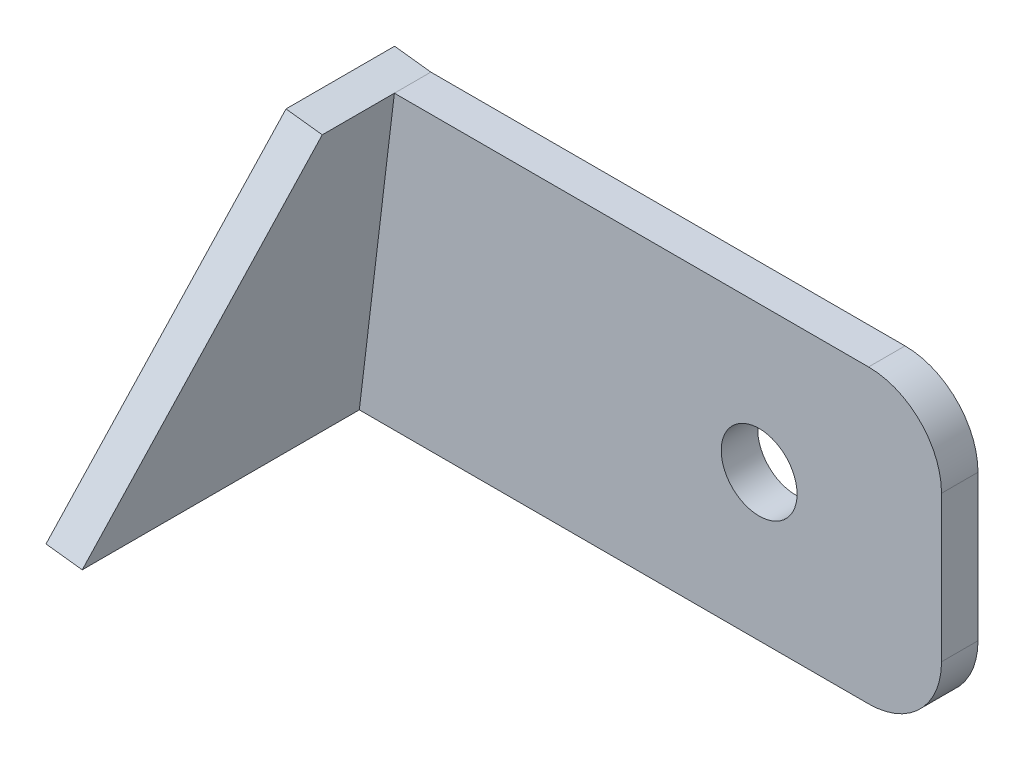
from build123d import *

# Parameters (mm, degrees)
BOSS_EXTRUDE1_DEPTH     = 3.175
CUT_EXTRUDE1_DEPTH      = 50.391408666
CUT_EXTRUDE1_DEPTH_BACK = 50.391408666
SKETCH3_R               = 3.302
SKETCH2_W               = 3.175
SKETCH2_H               = 6.4135
BOSS_EXTRUDE2_DEPTH     = 3.175
FILLET1_R               = 6.35


with BuildPart() as part:
    # Sketch1 → Boss-Extrude1 (new body)
    with BuildSketch(Plane.XY):
        Polygon((0, 12.7), (-3.051249826, -12.7), (0, -12.7), (47.625, -12.7), (47.625, 12.7), align=None)
        Polygon((-2.271161455, -6.206187377), (-0.780088372, 6.206187377), (-3.932424596, 6.584871053), (-5.42349768, -5.827503701), align=None)
    extrude(amount=BOSS_EXTRUDE1_DEPTH)

    # Sketch3 → Cut-Extrude1 (cut, two sides: drawn at the far end of the back side and taken through both)
    with BuildSketch(Plane.XY.offset(3.175).offset(-CUT_EXTRUDE1_DEPTH_BACK)):
        with Locations((31.75, 0)):
            Circle(SKETCH3_R)
    extrude(amount=CUT_EXTRUDE1_DEPTH + CUT_EXTRUDE1_DEPTH_BACK, mode=Mode.SUBTRACT)

    # Fillet1
    fillet1_edges = [part.edges().sort_by_distance(p)[0] for p in [
        (47.625, 12.7, 1.5875),
        (47.625, -12.7, 1.5875),
    ]]
    fillet(fillet1_edges, radius=FILLET1_R)


with BuildPart() as body_2:
    # Sketch2 → Boss-Extrude2 (new body)
    with BuildSketch(Plane(origin=(-1.503922228, 0.180663088, 0), x_dir=(0, 0, 1), z_dir=(-0.9928618030717177, 0.11927044898539502, 0))):
        with Locations((1.5875, -9.766518836)):
            Rectangle(SKETCH2_W, SKETCH2_H)
        Polygon((0, 12.609344899), (0, 6.195844899), (3.175, 6.195844899), (3.175, -6.432768836), (3.175, -6.559768836), (3.175, -12.973268836), (27.295308913, -12.973268836), (9.453791039, 12.609344899), align=None)
    extrude(amount=BOSS_EXTRUDE2_DEPTH)


solid = Compound([part.part, body_2.part])
